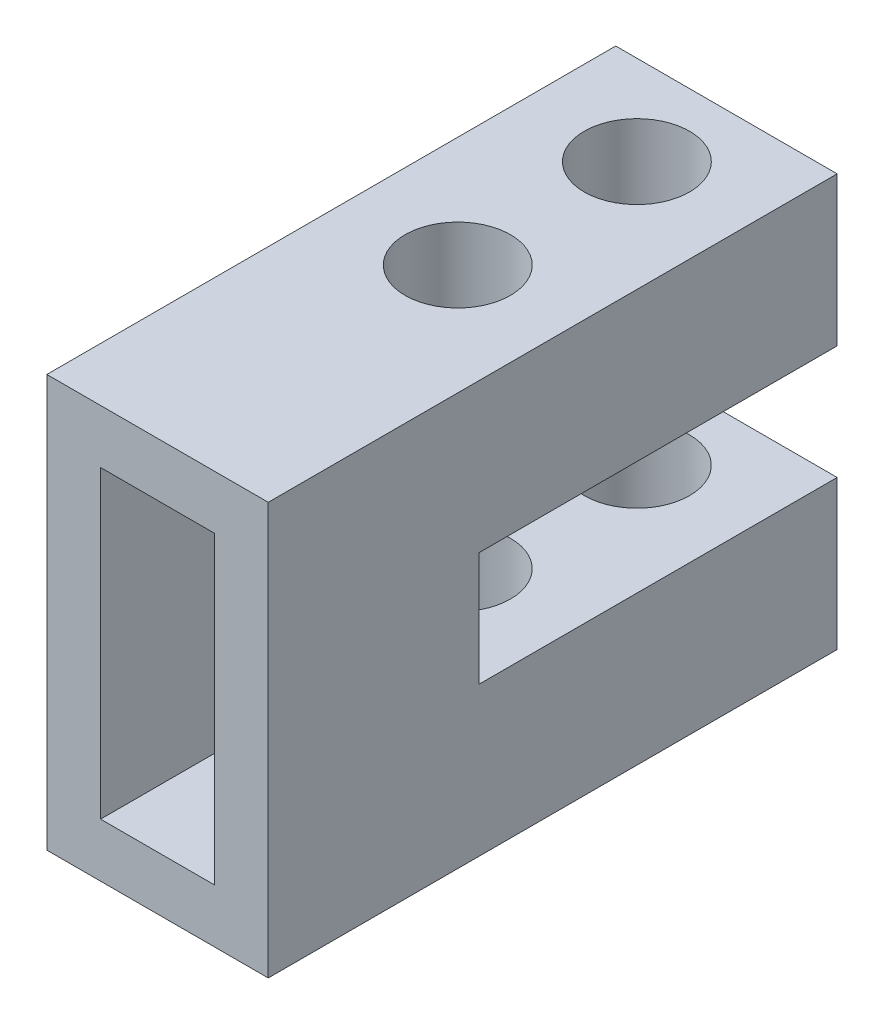
from build123d import *

# Parameters (mm, degrees)
SKETCH1_W           = 6.18
SKETCH1_H           = 11.5
SKETCH1_W_2         = 3.18
SKETCH1_H_2         = 8.5
BOSS_EXTRUDE1_DEPTH = 4.88
SKETCH2_W           = 6.18
SKETCH2_H           = 11.5
BOSS_EXTRUDE2_DEPTH = 1
SKETCH3_W           = 6.18
SKETCH3_H           = 4.16
BOSS_EXTRUDE3_DEPTH = 10
SKETCH4_R           = 1.47
CUT_EXTRUDE1_DEPTH  = 17.587718348


with BuildPart() as part:
    # Sketch1 → Boss-Extrude1 (new body)
    with BuildSketch(Plane.XY):
        with Locations((1.59, 4.25)):
            Rectangle(SKETCH1_W, SKETCH1_H)
        with Locations((1.59, 4.25)):
            Rectangle(SKETCH1_W_2, SKETCH1_H_2, mode=Mode.SUBTRACT)
    extrude(amount=BOSS_EXTRUDE1_DEPTH)

    # Sketch2 → Boss-Extrude2 (add)
    with BuildSketch(Plane(origin=(0, 0, 0), x_dir=(-1, 0, 0), z_dir=(0, 0, -1))):
        with Locations((-1.59, 4.25)):
            Rectangle(SKETCH2_W, SKETCH2_H)
    extrude(amount=BOSS_EXTRUDE2_DEPTH)

    # Sketch3 → Boss-Extrude3 (add)
    with BuildSketch(Plane(origin=(0, 0, -1), x_dir=(-1, 0, 0), z_dir=(0, 0, -1))):
        with Locations((-1.59, 7.92)):
            Rectangle(SKETCH3_W, SKETCH3_H)
        with Locations((-1.59, 0.58)):
            Rectangle(SKETCH3_W, SKETCH3_H)
    extrude(amount=BOSS_EXTRUDE3_DEPTH)

    # Sketch4 → Cut-Extrude1 (cut, through all)
    with BuildSketch(Plane(origin=(0, 10, 0), x_dir=(1, 0, 0), z_dir=(0, 1, 0))):
        with Locations(Location((1.59, 3.5, 0), (0, 0, 270))):
            Circle(SKETCH4_R)
        with Locations(Location((1.59, 8.5, 0), (0, 0, 270))):
            Circle(SKETCH4_R)
    extrude(amount=-CUT_EXTRUDE1_DEPTH, mode=Mode.SUBTRACT)


solid = part.part
